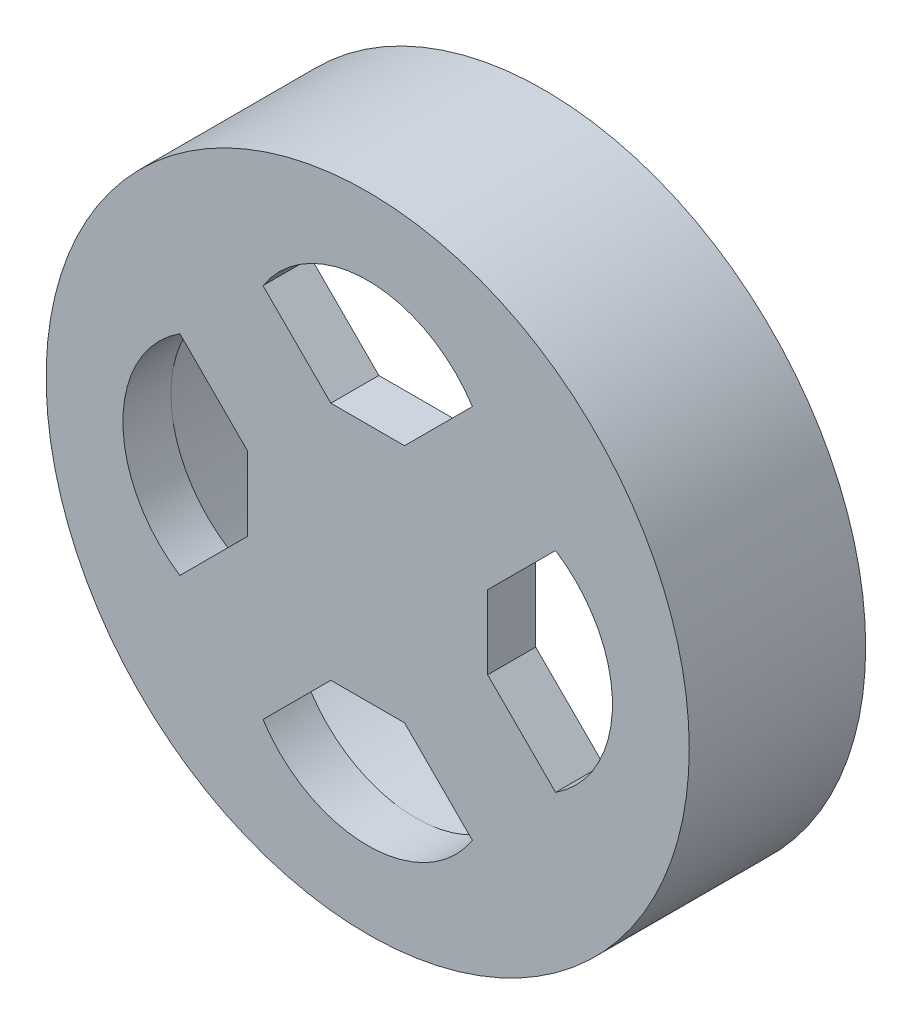
from build123d import *

# Parameters (mm, degrees)
SKETCH_1_R          = 33.5
EXTRUDE_1_DEPTH     = 18.38
CUT_EXTRUDE_1_DEPTH = 18.5
SKETCH_3_R          = 25.5
SKETCH_3_R_2        = 6
CUT_EXTRUDE_2_DEPTH = 13.38
EXTRUDE_START       = 3
SKETCH_5_R          = 6
EXTRUDE_2_DEPTH     = 3
CUT_EXTRUDE_3_DEPTH = 12


with BuildPart() as part:
    # 草图1 → 凸台-拉伸1 (new body)
    with BuildSketch(Plane.XY):
        Circle(SKETCH_1_R)
    extrude(amount=EXTRUDE_1_DEPTH)

    # 草图2 → 切除-拉伸1 (cut)
    with BuildSketch(Plane(origin=(0, 0, 0), x_dir=(-1, 0, 0), z_dir=(0, 0, -1))):
        with BuildLine():
            Line((-10.908712115, 19.571067812), (-3.837644303, 12.5))
            Line((-3.837644303, 12.5), (3.837644303, 12.5))
            Line((3.837644303, 12.5), (10.908712115, 19.571067812))
            ThreePointArc((10.908712115, 19.571067812), (0, 25.5), (-10.908712115, 19.571067812))
        make_face()
        with BuildLine():
            Line((19.571067812, 10.908712115), (12.5, 3.837644303))
            Line((12.5, 3.837644303), (12.5, -3.837644303))
            Line((12.5, -3.837644303), (19.571067812, -10.908712115))
            ThreePointArc((19.571067812, -10.908712115), (25.5, 0), (19.571067812, 10.908712115))
        make_face()
        with BuildLine():
            Line((10.908712115, -19.571067812), (3.837644303, -12.5))
            Line((3.837644303, -12.5), (-3.837644303, -12.5))
            Line((-3.837644303, -12.5), (-10.908712115, -19.571067812))
            ThreePointArc((-10.908712115, -19.571067812), (0, -25.5), (10.908712115, -19.571067812))
        make_face()
        with BuildLine():
            Line((-19.571067812, -10.908712115), (-12.5, -3.837644303))
            Line((-12.5, -3.837644303), (-12.5, 3.837644303))
            Line((-12.5, 3.837644303), (-19.571067812, 10.908712115))
            ThreePointArc((-19.571067812, 10.908712115), (-25.5, 0), (-19.571067812, -10.908712115))
        make_face()
    extrude(amount=-CUT_EXTRUDE_1_DEPTH, mode=Mode.SUBTRACT)

    # 草图3 → 切除-拉伸2 (cut)
    with BuildSketch(Plane(origin=(0, 0, 0), x_dir=(-1, 0, 0), z_dir=(0, 0, -1))):
        Circle(SKETCH_3_R)
        Circle(SKETCH_3_R_2, mode=Mode.SUBTRACT)
    extrude(amount=-CUT_EXTRUDE_2_DEPTH, mode=Mode.SUBTRACT)

    # 草图5 → 凸台-拉伸2 (add)
    with BuildSketch(Plane(origin=(0, 0, 0), x_dir=(-1, 0, 0), z_dir=(0, 0, -1)).offset(EXTRUDE_START)):
        Circle(SKETCH_5_R)
    extrude(amount=-EXTRUDE_2_DEPTH)

    # 草图6 → 切除-拉伸3 (cut)
    with BuildSketch(Plane(origin=(0, 0, -3), x_dir=(-1, 0, 0), z_dir=(0, 0, -1))):
        with BuildLine():
            Line((-1.947588252, 1.87), (1.947588252, 1.87))
            ThreePointArc((1.947588252, 1.87), (2.7, 0), (1.947588252, -1.87))
            Line((1.947588252, -1.87), (-1.947588252, -1.87))
            ThreePointArc((-1.947588252, -1.87), (-2.7, 0), (-1.947588252, 1.87))
        make_face()
    extrude(amount=-CUT_EXTRUDE_3_DEPTH, mode=Mode.SUBTRACT)


solid = part.part
